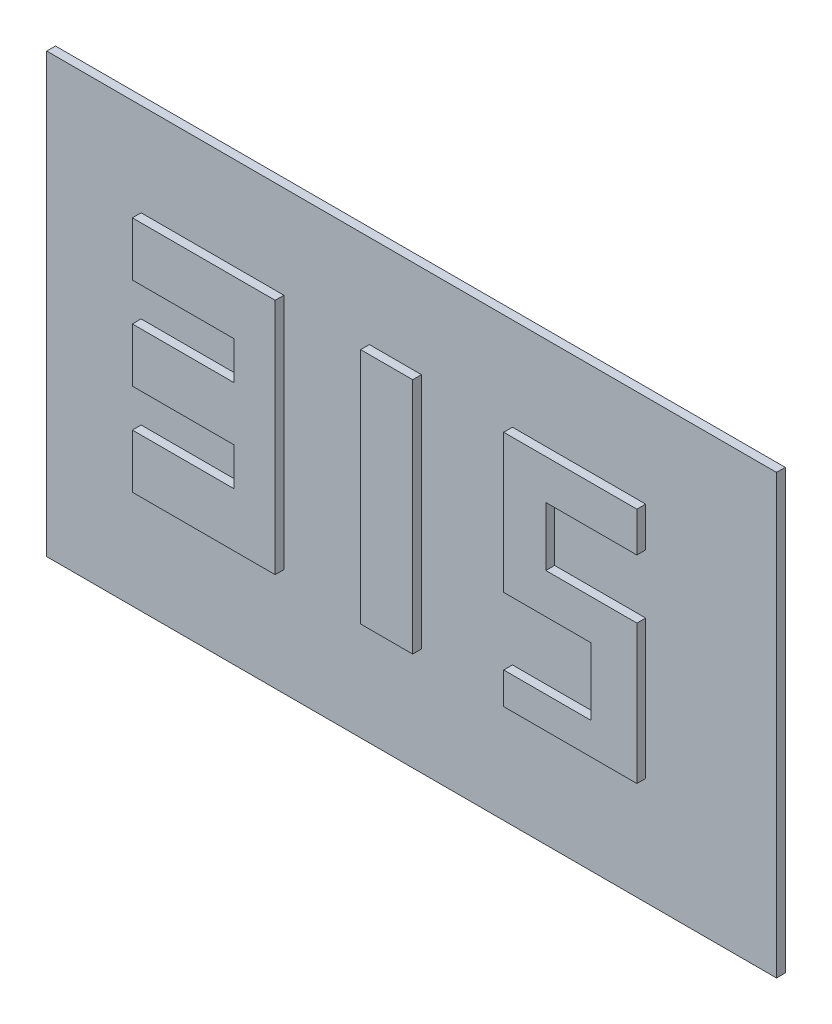
from build123d import *

# Parameters (mm, degrees)
SKETCH_1_W      = 115.514915432
SKETCH_1_H      = 71.054725524
EXTRUDE_1_DEPTH = 3
SKETCH_2_W      = 8.241625139
SKETCH_2_H      = 38.559694421
EXTRUDE_2_DEPTH = 3
SCALE_1_SCALE_X = 2.164314778
SCALE_1_SCALE_Y = 2.111189303
SCALE_1_SCALE_Z = 1


with BuildPart() as part:
    # 草图1 → 凸台-拉伸1 (new body)
    with BuildSketch(Plane.XY):
        with Locations((57.757457716, 35.527362762)):
            Rectangle(SKETCH_1_W, SKETCH_1_H)
    extrude(amount=EXTRUDE_1_DEPTH)

    # 草图2 → 凸台-拉伸2 (add)
    with BuildSketch(Plane.XY.offset(3)):
        Polygon((14.936991477, 55.983341955), (37.539998531, 55.983341955), (37.539998531, 17.423647534), (14.936991477, 17.423647534), (14.936991477, 26.16273518), (31.006011192, 26.16273518), (31.006011192, 32.333950921), (14.936991477, 32.333950921), (14.936991477, 41.073038567), (31.006011192, 41.073038567), (31.006011192, 47.244254309), (14.936991477, 47.244254309), align=None)
        Polygon((73.719694368, 17.423647534), (94.800903935, 17.423647534), (94.800903935, 39.973675083), (80.392398912, 39.973675083), (80.392398912, 49.539853279), (94.800903935, 49.539853279), (94.800903935, 55.983341955), (73.719694368, 55.983341955), (73.719694368, 33.478121987), (87.513572233, 33.478121987), (87.513572233, 22.575407484), (73.719694368, 22.575407484), align=None)
        with Locations((55.191084261, 36.703494744)):
            Rectangle(SKETCH_2_W, SKETCH_2_H)
    extrude(amount=EXTRUDE_2_DEPTH)


with BuildPart() as part_1:
    # 缩放比例1: scaled about (56.997017768, 35.730737943, 1.967633453)
    add(part.part.scale((SCALE_1_SCALE_X, SCALE_1_SCALE_Y, SCALE_1_SCALE_Z), about=(56.997017768, 35.730737943, 1.967633453)))


solid = part_1.part
